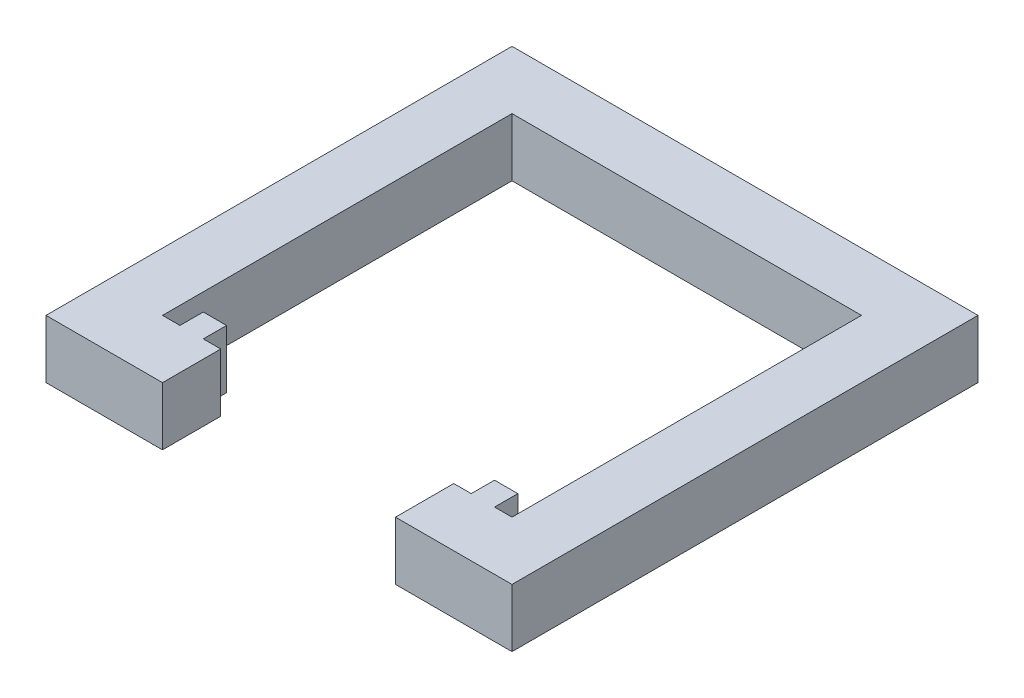
from build123d import *

# Parameters (mm, degrees)
SKETCH1_W           = 50
SKETCH1_H           = 50
SKETCH1_W_2         = 20
SKETCH1_H_2         = 20
BOSS_EXTRUDE1_DEPTH = 50


with BuildPart() as part:
    # Sketch1 → Boss-Extrude1 (new body)
    with BuildSketch(Plane(origin=(0, 0, 0), x_dir=(1, 0, 0), z_dir=(0, 1, 0))):
        Polygon((-98.419958922, -10.98752745), (-151.112267161, -10.98752745), (-151.112267161, -219.278466068), (-151.112267161, -380.152018312), (-151.112267161, -410.98752745), (-101.112267161, -410.98752745), (-101.112267161, -360.98752745), (-101.112267161, -60.98752745), (198.887732839, -60.98752745), (198.887732839, -360.98752745), (198.887732839, -410.98752745), (248.887732839, -410.98752745), (248.887732839, -380.152018312), (248.887732839, -219.278466068), (248.887732839, -10.98752745), (169.957323972, -10.98752745), align=None)
        with Locations((173.887732839, -385.98752745)):
            Rectangle(SKETCH1_W, SKETCH1_H)
        Polygon((-101.112267161, -360.98752745), (-101.112267161, -410.98752745), (-51.112267161, -410.98752745), (-51.112267161, -360.98752745), (-66.112267161, -360.98752745), (-86.112267161, -360.98752745), align=None)
        with Locations((-76.112267161, -350.98752745)):
            Rectangle(SKETCH1_W_2, SKETCH1_H_2)
        with Locations((173.887732839, -350.98752745)):
            Rectangle(SKETCH1_W_2, SKETCH1_H_2)
    extrude(amount=BOSS_EXTRUDE1_DEPTH)


solid = part.part
